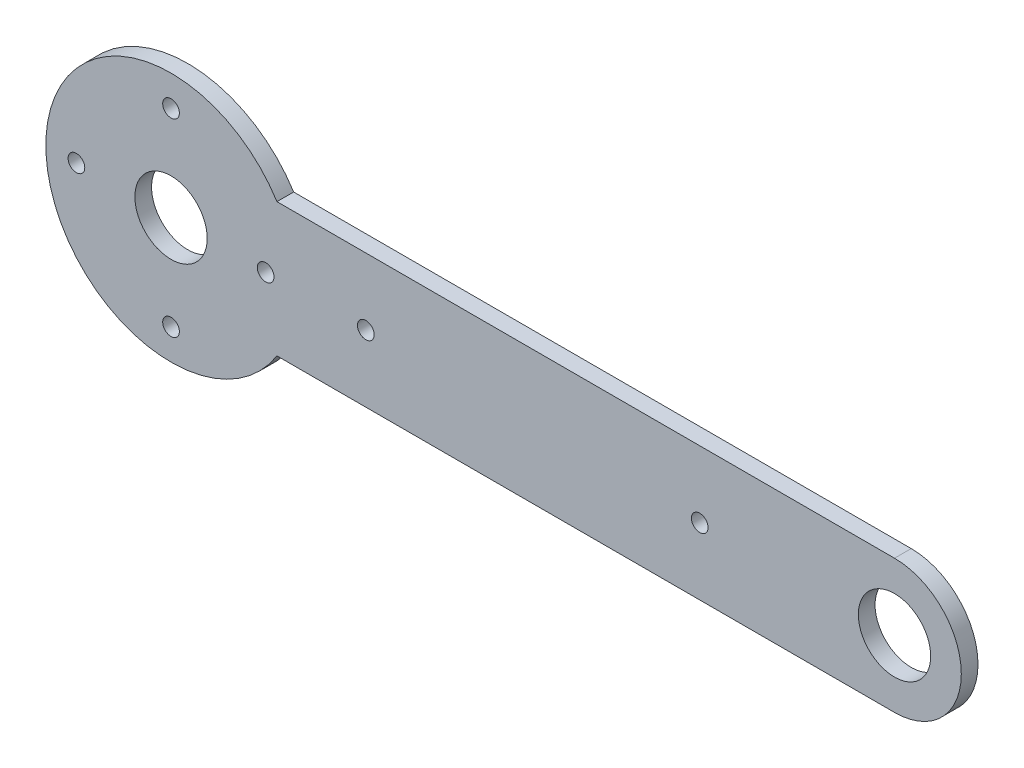
from build123d import *

# Parameters (mm, degrees)
BOSS_EXTRU_1_DEPTH           = 3
ESQUISSE2_R                  = 6.5
ENL_V_MAT_EXTRU_1_DEPTH      = 78.987178433
ENL_V_MAT_EXTRU_2_DEPTH      = 78.987178433
ENL_V_MAT_EXTRU_2_DEPTH_BACK = 78.987178433
ESQUISSE4_R                  = 1.5
ESQUISSE5_R                  = 22.5
ESQUISSE5_R_2                = 6.5
BOSS_EXTRU_2_DEPTH           = 3
ESQUISSE6_R                  = 1.5
ENL_V_MAT_EXTRU_3_DEPTH      = 91.396349484


with BuildPart() as part:
    # Esquisse1 → Boss.-Extru.1 (new body)
    with BuildSketch(Plane.XY):
        with BuildLine():
            Line((-65, 12), (65, 12))
            ThreePointArc((65, 12), (77, 0), (65, -12))
            Line((65, -12), (-65, -12))
            ThreePointArc((-65, -12), (-77, 0), (-65, 12))
        make_face()
    extrude(amount=BOSS_EXTRU_1_DEPTH)

    # Esquisse2 → Enlèv. mat.-Extru.1 (cut, through all)
    with BuildSketch(Plane.XY.offset(3)):
        with Locations((-65, 0)):
            Circle(ESQUISSE2_R)
        with Locations(Location((65, 0, 0), (0, 0, 180))):
            Circle(ESQUISSE2_R)
    extrude(amount=-ENL_V_MAT_EXTRU_1_DEPTH, mode=Mode.SUBTRACT)

    # Esquisse4 → Enlèv. mat.-Extru.2 (cut, two sides: drawn at the far end of the back side and taken through both)
    with BuildSketch(Plane.XY.offset(3).offset(-ENL_V_MAT_EXTRU_2_DEPTH_BACK)):
        with Locations((-30, 0)):
            Circle(ESQUISSE4_R)
        with Locations(Location((30, 0, 0), (0, 0, 180))):
            Circle(ESQUISSE4_R)
    extrude(amount=ENL_V_MAT_EXTRU_2_DEPTH + ENL_V_MAT_EXTRU_2_DEPTH_BACK, mode=Mode.SUBTRACT)

    # Esquisse5 → Boss.-Extru.2 (add)
    with BuildSketch(Plane.XY.offset(3)):
        with Locations((-65, 0)):
            Circle(ESQUISSE5_R)
        with Locations((-65, 0)):
            Circle(ESQUISSE5_R_2, mode=Mode.SUBTRACT)
    extrude(amount=-BOSS_EXTRU_2_DEPTH)

    # Esquisse6 → Enlèv. mat.-Extru.3 (cut, through all)
    with BuildSketch(Plane.XY.offset(3)):
        with Locations((-65, 17)):
            Circle(ESQUISSE6_R)
        with Locations((-48, 0)):
            Circle(ESQUISSE6_R)
        with Locations((-65, -17)):
            Circle(ESQUISSE6_R)
        with Locations((-82, 0)):
            Circle(ESQUISSE6_R)
    extrude(amount=-ENL_V_MAT_EXTRU_3_DEPTH, mode=Mode.SUBTRACT)


solid = part.part
